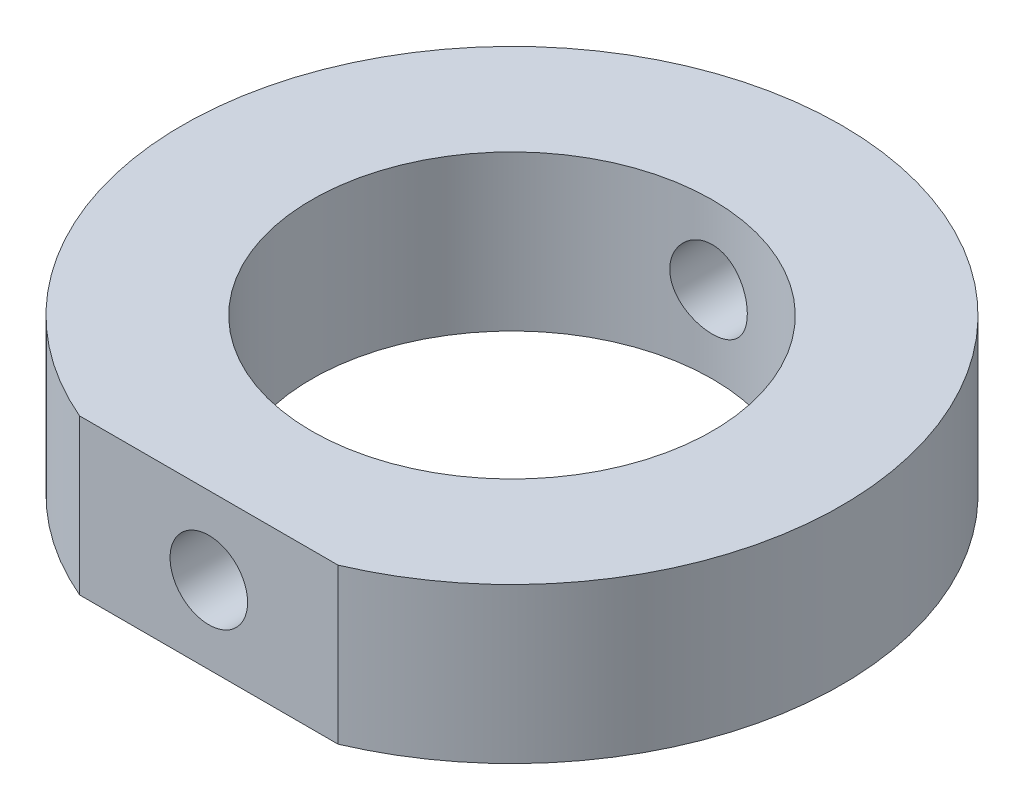
from build123d import *

# Parameters (mm, degrees)
SKETCH1_R           = 7.75
BOSS_EXTRUDE1_DEPTH = 6
SKETCH2_R           = 1.5
CUT_EXTRUDE1_DEPTH  = 29.244812881


with BuildPart() as part:
    # Sketch1 → Boss-Extrude1 (new body)
    with BuildSketch(Plane(origin=(0, 0, 0), x_dir=(1, 0, 0), z_dir=(0, 1, 0))):
        with BuildLine():
            Line((-5, -11.728704106), (5, -11.728704106))
            ThreePointArc((5, -11.728704106), (0, 12.75), (-5, -11.728704106))
        make_face()
        with Locations(Location((0, 0, 0), (0, 0, 270))):
            Circle(SKETCH1_R, mode=Mode.SUBTRACT)
    extrude(amount=BOSS_EXTRUDE1_DEPTH)

    # Sketch2 → Cut-Extrude1 (cut, through all)
    with BuildSketch(Plane.XY.offset(11.728704106)):
        with Locations((0, 3)):
            Circle(SKETCH2_R)
    extrude(amount=-CUT_EXTRUDE1_DEPTH, mode=Mode.SUBTRACT)


solid = part.part
